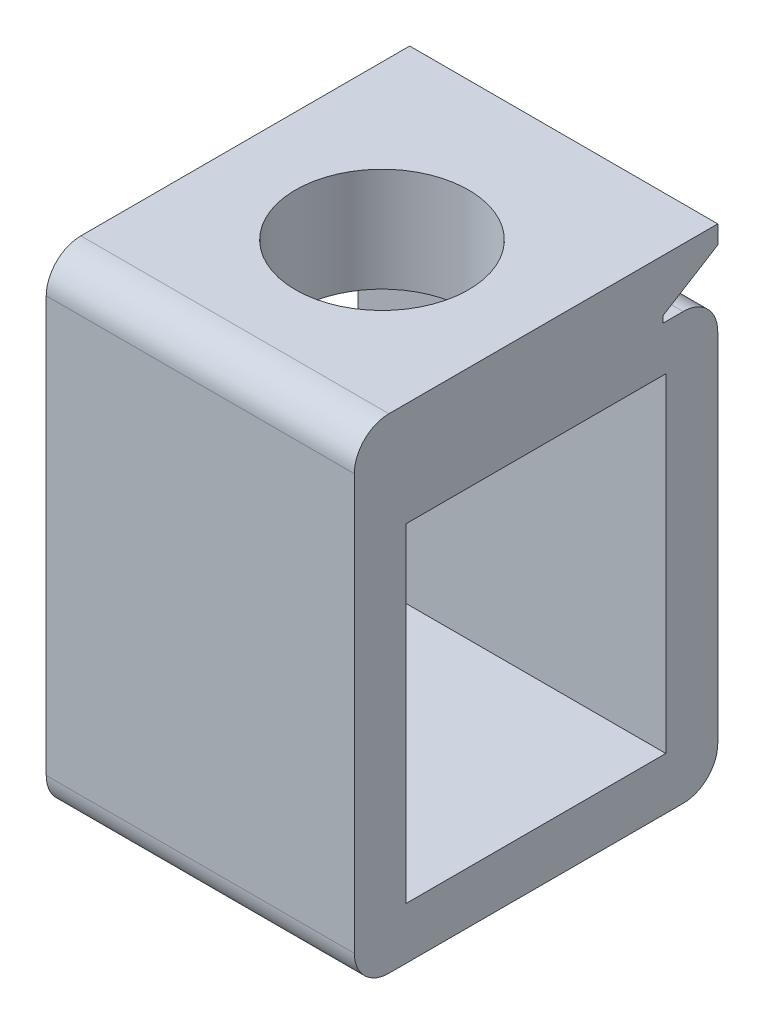
from build123d import *

# Parameters (mm, degrees)
EXTRUDE_1_DEPTH          = 4.45
EXTRUDE_1_DEPTH_BACK     = 4.45
SKETCH_1_W               = 10.5
SKETCH_1_H               = 14
SKETCH_1_W_2             = 7.5
SKETCH_1_H_2             = 9.5
SKETCH_2_R               = 2.5
CUT_EXTRUDE_1_DEPTH      = 5
CUT_EXTRUDE_2_DEPTH      = 13.480885385
CUT_EXTRUDE_2_DEPTH_BACK = 13.480885385
FILLET_1_R               = 1


with BuildPart() as part:
    # 草图1 → 凸台-拉伸1 (new, two sides: drawn at the far end of the back side and taken through both)
    with BuildSketch(Plane(origin=(0, 0, 0), x_dir=(0, 0, -1), z_dir=(1, 0, 0)).offset(-EXTRUDE_1_DEPTH_BACK)):
        Rectangle(SKETCH_1_W, SKETCH_1_H)
        with Locations((0, -0.75)):
            Rectangle(SKETCH_1_W_2, SKETCH_1_H_2, mode=Mode.SUBTRACT)
    extrude(amount=EXTRUDE_1_DEPTH + EXTRUDE_1_DEPTH_BACK)

    # 草图2 → 切除-拉伸1 (cut)
    with BuildSketch(Plane(origin=(0, 7, 0), x_dir=(1, 0, 0), z_dir=(0, 1, 0))):
        Circle(SKETCH_2_R)
    extrude(amount=-CUT_EXTRUDE_1_DEPTH, mode=Mode.SUBTRACT)

    # 草图3 → 切除-拉伸2 (cut, two sides: drawn at the far end of the back side and taken through both)
    with BuildSketch(Plane(origin=(4.45, 0, 0), x_dir=(0, 0, -1), z_dir=(1, 0, 0)).offset(-CUT_EXTRUDE_2_DEPTH_BACK)):
        Polygon((42.829414647, 29.662513803), (5.25, 6.470985869), (3.661056498, 5.490395087), (3.661056498, 5.306534315), (5.25, 5.306534315), (49.409476594, 5.306534315), (134.671683999, 28.341149153), (128.091622051, 52.697128641), align=None)
    extrude(amount=CUT_EXTRUDE_2_DEPTH + CUT_EXTRUDE_2_DEPTH_BACK, mode=Mode.SUBTRACT)

    # 圆角1
    fillet_1_edges = [part.edges().sort_by_distance(p)[0] for p in [
        (0, -7, -5.25),
        (0, -7, 5.25),
        (0, 7, 5.25),
        (0, 5.306534315, -5.25),
    ]]
    fillet(fillet_1_edges, radius=FILLET_1_R)


solid = part.part
